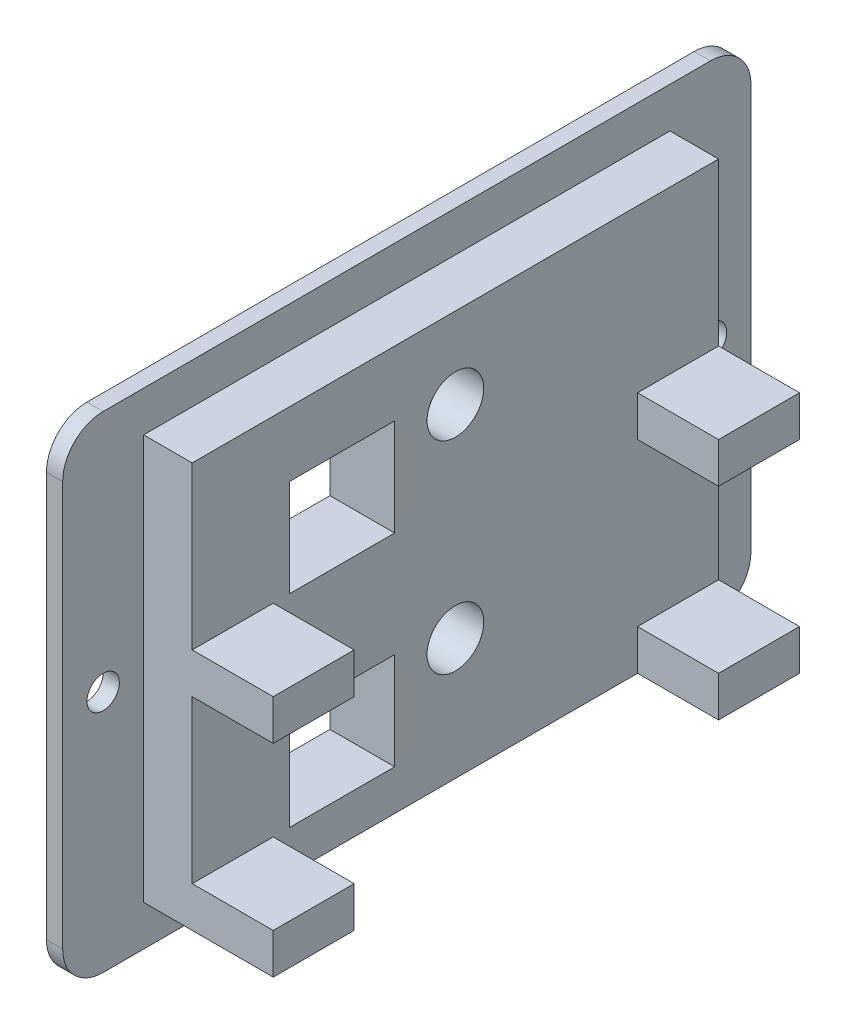
from build123d import *

# Parameters (mm, degrees)
SKETCH1_W           = 85
SKETCH1_H           = 60
BOSS_EXTRUDE1_DEPTH = 1
SKETCH2_W           = 65
SKETCH2_H           = 50
BOSS_EXTRUDE2_DEPTH = 6
SKETCH3_W           = 10
SKETCH3_H           = 5
BOSS_EXTRUDE3_DEPTH = 10
SKETCH4_R           = 2
CUT_EXTRUDE1_DEPTH  = 10
SKETCH5_W           = 85
SKETCH5_H           = 60
SKETCH5_R           = 2
BOSS_EXTRUDE4_DEPTH = 1
SKETCH6_R           = 3.5
SKETCH6_W           = 13
SKETCH6_H           = 12
CUT_EXTRUDE2_DEPTH  = 10
FILLET1_R           = 5
FILLET2_R           = 5
FILLET3_R           = 5
FILLET4_R           = 5


with BuildPart() as part:
    # Sketch1 → Boss-Extrude1 (new body)
    with BuildSketch(Plane(origin=(0, 0, 0), x_dir=(0, 0, -1), z_dir=(1, 0, 0))):
        with Locations((42.5, 30)):
            Rectangle(SKETCH1_W, SKETCH1_H)
    extrude(amount=BOSS_EXTRUDE1_DEPTH)

    # Sketch2 → Boss-Extrude2 (add)
    with BuildSketch(Plane(origin=(1, 0, 0), x_dir=(0, 0, -1), z_dir=(1, 0, 0))):
        with Locations((42.5, 30)):
            Rectangle(SKETCH2_W, SKETCH2_H)
    extrude(amount=BOSS_EXTRUDE2_DEPTH)

    # Sketch3 → Boss-Extrude3 (add)
    with BuildSketch(Plane(origin=(7, 0, 0), x_dir=(0, 0, -1), z_dir=(1, 0, 0))):
        with Locations((15, 7.5)):
            Rectangle(SKETCH3_W, SKETCH3_H)
        with Locations((70, 7.5)):
            Rectangle(SKETCH3_W, SKETCH3_H)
        with Locations((15, 32.5)):
            Rectangle(SKETCH3_W, SKETCH3_H)
        with Locations((70, 32.5)):
            Rectangle(SKETCH3_W, SKETCH3_H)
    extrude(amount=BOSS_EXTRUDE3_DEPTH)

    # Sketch4 → Cut-Extrude1 (cut)
    with BuildSketch(Plane(origin=(1, 0, 0), x_dir=(0, 0, -1), z_dir=(1, 0, 0))):
        with Locations((5, 30)):
            Circle(SKETCH4_R)
        with Locations((80, 30)):
            Circle(SKETCH4_R)
    extrude(amount=-CUT_EXTRUDE1_DEPTH, mode=Mode.SUBTRACT)

    # Sketch5 → Boss-Extrude4 (add)
    with BuildSketch(Plane.ZY):
        with Locations((-42.5, 30)):
            Rectangle(SKETCH5_W, SKETCH5_H)
        with Locations(Location((-80, 30, 0), (0, 0, 180))):
            Circle(SKETCH5_R, mode=Mode.SUBTRACT)
        with Locations(Location((-5, 30, 0), (0, 0, 180))):
            Circle(SKETCH5_R, mode=Mode.SUBTRACT)
    extrude(amount=BOSS_EXTRUDE4_DEPTH)

    # Sketch6 → Cut-Extrude2 (cut)
    with BuildSketch(Plane.ZY.offset(1)):
        with Locations((-42.5, 45)):
            Circle(SKETCH6_R)
        with Locations((-42.5, 20)):
            Circle(SKETCH6_R)
        with Locations((-28.5, 41)):
            Rectangle(SKETCH6_W, SKETCH6_H)
        with Locations((-28.5, 16)):
            Rectangle(SKETCH6_W, SKETCH6_H)
    extrude(amount=-CUT_EXTRUDE2_DEPTH, mode=Mode.SUBTRACT)

    # Fillet1
    fillet1_edges = [part.edges().sort_by_distance(p)[0] for p in [
        (0, 60, 0),
    ]]
    fillet(fillet1_edges, radius=FILLET1_R)

    # Fillet2
    fillet2_edges = [part.edges().sort_by_distance(p)[0] for p in [
        (0, 0, 0),
    ]]
    fillet(fillet2_edges, radius=FILLET2_R)

    # Fillet3
    fillet3_edges = [part.edges().sort_by_distance(p)[0] for p in [
        (0, 60, -85),
    ]]
    fillet(fillet3_edges, radius=FILLET3_R)

    # Fillet4
    fillet4_edges = [part.edges().sort_by_distance(p)[0] for p in [
        (0, 0, -85),
    ]]
    fillet(fillet4_edges, radius=FILLET4_R)


solid = part.part
